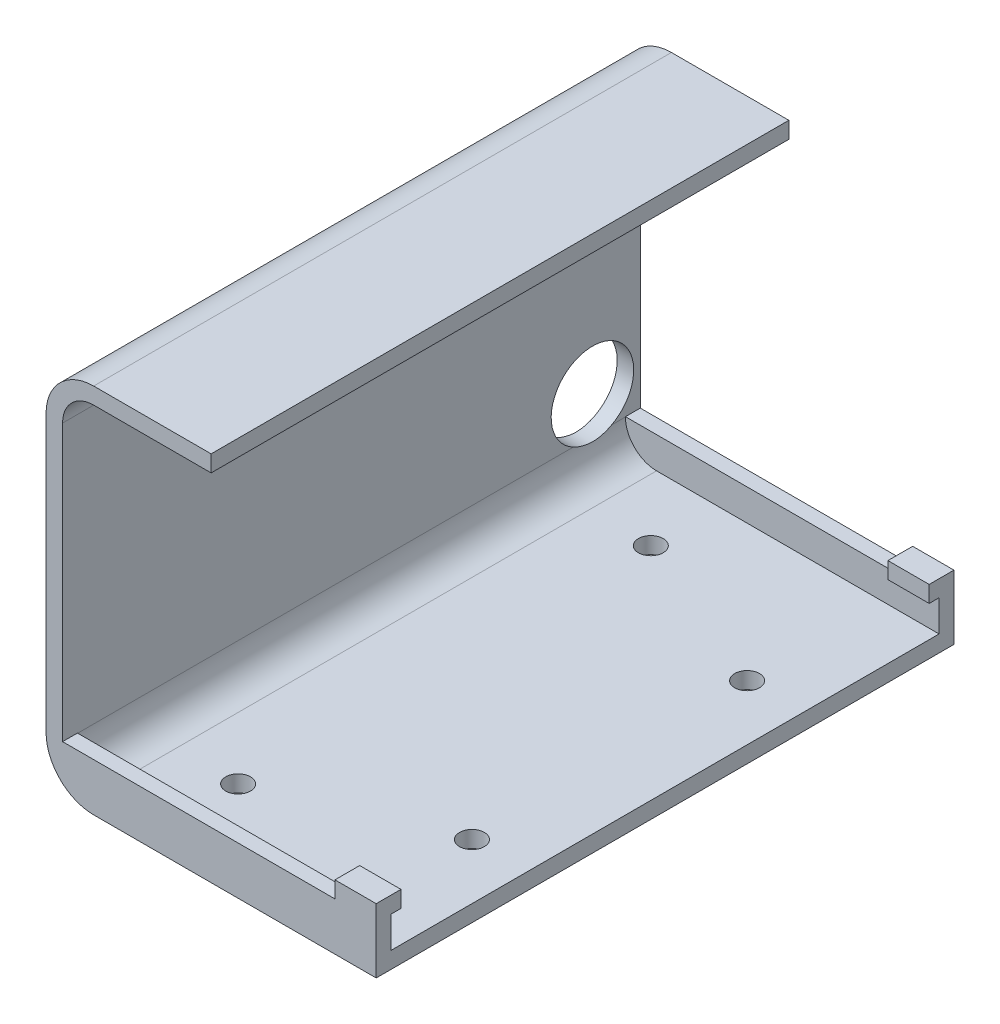
from build123d import *

# Parameters (mm, degrees)
BOSS_EXTRUDE1_DEPTH = 70
BOSS_EXTRUDE3_REACH = 86.63
SKETCH3_W           = 1.8
SKETCH3_H           = 3.8
SKETCH4_W           = 5
SKETCH4_H           = 3
BOSS_EXTRUDE4_DEPTH = 2
CUT_EXTRUDE1_REACH  = 90.595
SKETCH5_R           = 1.5
CUT_EXTRUDE2_REACH  = 86.63
SKETCH6_R           = 5


with BuildPart() as part:
    # Sketch1 → Boss-Extrude1 (new body)
    with BuildSketch(Plane.XY):
        with BuildLine():
            Line((-30.398230088, 19.964424779), (-30.398230088, -13.495575221))
            ThreePointArc((-30.398230088, -13.495575221), (-28.708236216, -17.575581349), (-24.628230088, -19.265575221))
            Line((-24.628230088, -19.265575221), (9.601769912, -19.265575221))
            Line((9.601769912, -19.265575221), (9.601769912, -17.265575221))
            Line((9.601769912, -17.265575221), (-24.628230088, -17.265575221))
            ThreePointArc((-24.628230088, -17.265575221), (-27.294022654, -16.161367786), (-28.398230088, -13.495575221))
            Line((-28.398230088, -13.495575221), (-28.398230088, 19.964424779))
            ThreePointArc((-28.398230088, 19.964424779), (-27.294022654, 22.630217344), (-24.628230088, 23.734424779))
            Line((-24.628230088, 23.734424779), (-10.398230088, 23.734424779))
            Line((-10.398230088, 23.734424779), (-10.398230088, 25.734424779))
            Line((-10.398230088, 25.734424779), (-24.628230088, 25.734424779))
            ThreePointArc((-24.628230088, 25.734424779), (-28.708236216, 24.044430906), (-30.398230088, 19.964424779))
        make_face()
    extrude(amount=BOSS_EXTRUDE1_DEPTH)

    # Sketch3 → Boss-Extrude3 (add, up to next)
    with BuildSketch(Plane(origin=(9.601769912, 0, 0), x_dir=(0, 0, -1), z_dir=(1, 0, 0)), mode=Mode.PRIVATE) as boss_extrude3_sk1:
        with Locations((-69.1, -15.365575221)):
            Rectangle(SKETCH3_W, SKETCH3_H)
    boss_extrude3_tool1 = extrude(boss_extrude3_sk1.sketch, amount=-BOSS_EXTRUDE3_REACH, mode=Mode.PRIVATE) - part.part
    # Sketch3 → Boss-Extrude3 (add, up to next)
    with BuildSketch(Plane(origin=(9.601769912, 0, 0), x_dir=(0, 0, -1), z_dir=(1, 0, 0)), mode=Mode.PRIVATE) as boss_extrude3_sk2:
        with Locations((-0.9, -15.365575221)):
            Rectangle(SKETCH3_W, SKETCH3_H)
    boss_extrude3_tool2 = extrude(boss_extrude3_sk2.sketch, amount=-BOSS_EXTRUDE3_REACH, mode=Mode.PRIVATE) - part.part
    add(boss_extrude3_tool1.solids().sort_by_distance((9.60177, -15.365575, 69.1))[0])
    add(boss_extrude3_tool2.solids().sort_by_distance((9.60177, -15.365575, 0.9))[0])

    # Sketch4 → Boss-Extrude4 (add)
    with BuildSketch(Plane(origin=(0, -13.465575221, 0), x_dir=(1, 0, 0), z_dir=(0, 1, 0))):
        with Locations((7.101769912, -68.5)):
            Rectangle(SKETCH4_W, SKETCH4_H)
        with Locations((7.101769912, -1.5)):
            Rectangle(SKETCH4_W, SKETCH4_H)
    extrude(amount=BOSS_EXTRUDE4_DEPTH)

    # Sketch5 → Cut-Extrude1 (cut, up to next)
    with BuildSketch(Plane(origin=(0, -19.265575221, 0), x_dir=(-1, 0, 0), z_dir=(0, -1, 0)), mode=Mode.PRIVATE) as cut_extrude1_sk1:
        with Locations(Location((17.128230088, -60, 0), (0, 0, 180))):
            Circle(SKETCH5_R)
    cut_extrude1_tool1 = extrude(cut_extrude1_sk1.sketch, amount=-CUT_EXTRUDE1_REACH, mode=Mode.PRIVATE) & part.part
    # Sketch5 → Cut-Extrude1 (cut, up to next)
    with BuildSketch(Plane(origin=(0, -19.265575221, 0), x_dir=(-1, 0, 0), z_dir=(0, -1, 0)), mode=Mode.PRIVATE) as cut_extrude1_sk2:
        with Locations(Location((17.128230088, -10, 0), (0, 0, 90))):
            Circle(SKETCH5_R)
    cut_extrude1_tool2 = extrude(cut_extrude1_sk2.sketch, amount=-CUT_EXTRUDE1_REACH, mode=Mode.PRIVATE) & part.part
    # Sketch5 → Cut-Extrude1 (cut, up to next)
    with BuildSketch(Plane(origin=(0, -19.265575221, 0), x_dir=(-1, 0, 0), z_dir=(0, -1, 0)), mode=Mode.PRIVATE) as cut_extrude1_sk3:
        with Locations(Location((-2.871769912, -51.67, 0), (0, 0, 180))):
            Circle(SKETCH5_R)
    cut_extrude1_tool3 = extrude(cut_extrude1_sk3.sketch, amount=-CUT_EXTRUDE1_REACH, mode=Mode.PRIVATE) & part.part
    # Sketch5 → Cut-Extrude1 (cut, up to next)
    with BuildSketch(Plane(origin=(0, -19.265575221, 0), x_dir=(-1, 0, 0), z_dir=(0, -1, 0)), mode=Mode.PRIVATE) as cut_extrude1_sk4:
        with Locations(Location((-2.871769912, -18.33, 0), (0, 0, 90))):
            Circle(SKETCH5_R)
    cut_extrude1_tool4 = extrude(cut_extrude1_sk4.sketch, amount=-CUT_EXTRUDE1_REACH, mode=Mode.PRIVATE) & part.part
    add(cut_extrude1_tool1.solids().sort_by_distance((-17.12823, -19.265575, 60))[0], mode=Mode.SUBTRACT)
    add(cut_extrude1_tool2.solids().sort_by_distance((-17.12823, -19.265575, 10))[0], mode=Mode.SUBTRACT)
    add(cut_extrude1_tool3.solids().sort_by_distance((2.87177, -19.265575, 51.67))[0], mode=Mode.SUBTRACT)
    add(cut_extrude1_tool4.solids().sort_by_distance((2.87177, -19.265575, 18.33))[0], mode=Mode.SUBTRACT)

    # Sketch6 → Cut-Extrude2 (cut, up to next)
    with BuildSketch(Plane.ZY.offset(30.398230088), mode=Mode.PRIVATE) as cut_extrude2_sk1:
        with Locations(Location((5.8, -9.065575221, 0), (0, 0, 297.625166054))):
            Circle(SKETCH6_R)
    cut_extrude2_tool1 = extrude(cut_extrude2_sk1.sketch, amount=-CUT_EXTRUDE2_REACH, mode=Mode.PRIVATE) & part.part
    add(cut_extrude2_tool1.solids().sort_by_distance((-30.39823, -9.065575, 5.8))[0], mode=Mode.SUBTRACT)


solid = part.part
